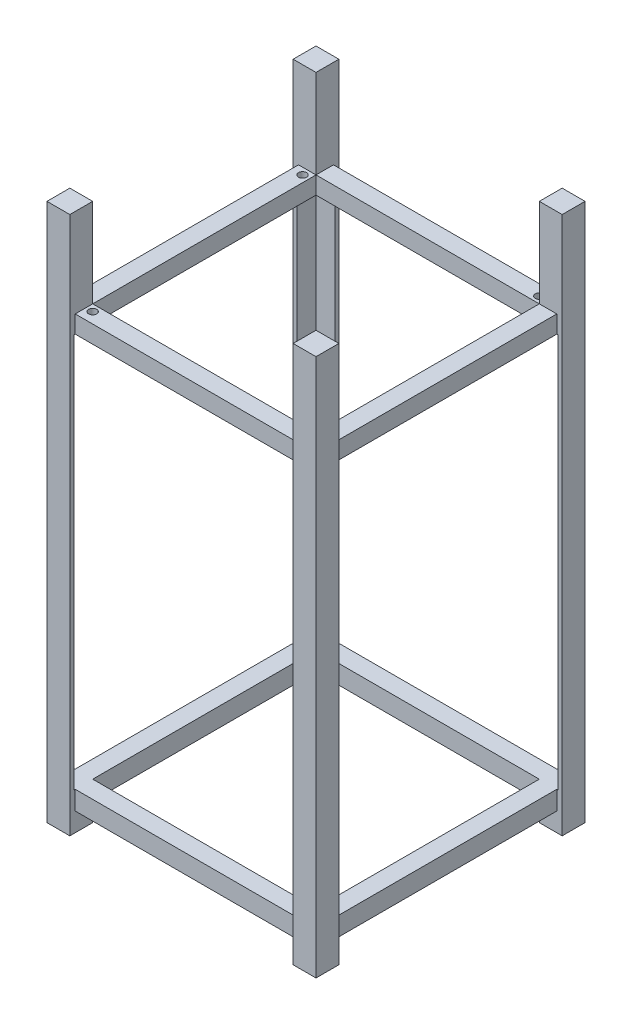
from build123d import *

# Parameters (mm, degrees)
SKETCH1_W           = 100
SKETCH1_H           = 100
BOSS_EXTRUDE1_DEPTH = 200
SKETCH2_W           = 83
SKETCH2_H           = 83
CUT_EXTRUDE1_DEPTH  = 200
SKETCH3_W           = 83
SKETCH3_H           = 14
SKETCH3_H_2         = 146.5
SKETCH3_H_3         = 66
CUT_EXTRUDE2_DEPTH  = 200
SKETCH4_W           = 83
SKETCH4_H           = 14
SKETCH4_H_2         = 146.5
SKETCH4_H_3         = 66
CUT_EXTRUDE3_DEPTH  = 200
SKETCH5_W           = 83
SKETCH5_H           = 4
SKETCH5_W_2         = 4
SKETCH5_H_2         = 83
CUT_EXTRUDE4_DEPTH  = 200
SKETCH8_W           = 97
SKETCH8_H           = 97
CUT_EXTRUDE5_DEPTH  = 146.5
CUT_EXTRUDE6_REACH  = 220.836
SKETCH9_R           = 1.5


with BuildPart() as part:
    # Sketch1 → Boss-Extrude1 (new body)
    with BuildSketch(Plane(origin=(0, 0, 0), x_dir=(1, 0, 0), z_dir=(0, 1, 0))):
        with Locations((50, 50)):
            Rectangle(SKETCH1_W, SKETCH1_H)
    extrude(amount=BOSS_EXTRUDE1_DEPTH)

    # Sketch2 → Cut-Extrude1 (cut)
    with BuildSketch(Plane(origin=(0, 200, 0), x_dir=(1, 0, 0), z_dir=(0, 1, 0))):
        with Locations((50, 50)):
            Rectangle(SKETCH2_W, SKETCH2_H)
    extrude(amount=-CUT_EXTRUDE1_DEPTH, mode=Mode.SUBTRACT)

    # Sketch3 → Cut-Extrude2 (cut)
    with BuildSketch(Plane.XY):
        with Locations((50, 0)):
            Rectangle(SKETCH3_W, SKETCH3_H)
        with Locations((50, 87.25)):
            Rectangle(SKETCH3_W, SKETCH3_H_2)
        with Locations((50, 200)):
            Rectangle(SKETCH3_W, SKETCH3_H_3)
    extrude(amount=-CUT_EXTRUDE2_DEPTH, mode=Mode.SUBTRACT)

    # Sketch4 → Cut-Extrude3 (cut)
    with BuildSketch(Plane.ZY):
        with Locations((-50, 0)):
            Rectangle(SKETCH4_W, SKETCH4_H)
        with Locations((-50, 87.25)):
            Rectangle(SKETCH4_W, SKETCH4_H_2)
        with Locations((-50, 200)):
            Rectangle(SKETCH4_W, SKETCH4_H_3)
    extrude(amount=-CUT_EXTRUDE3_DEPTH, mode=Mode.SUBTRACT)

    # Sketch5 → Cut-Extrude4 (cut)
    with BuildSketch(Plane.XZ.offset(-7)):
        with Locations((50, 0)):
            Rectangle(SKETCH5_W, SKETCH5_H)
        with Locations((100, -50)):
            Rectangle(SKETCH5_W_2, SKETCH5_H_2)
        with Locations((50, -100)):
            Rectangle(SKETCH5_W, SKETCH5_H)
        with Locations((0, -50)):
            Rectangle(SKETCH5_W_2, SKETCH5_H_2)
    extrude(amount=-CUT_EXTRUDE4_DEPTH, mode=Mode.SUBTRACT)

    # Sketch8 → Cut-Extrude5 (cut)
    with BuildSketch(Plane.XZ.offset(-160.5)):
        with Locations((50, -50)):
            Rectangle(SKETCH8_W, SKETCH8_H)
    extrude(amount=CUT_EXTRUDE5_DEPTH, mode=Mode.SUBTRACT)

    # Sketch9 → Cut-Extrude6 (cut, up to next)
    with BuildSketch(Plane(origin=(0, 167, 0), x_dir=(1, 0, 0), z_dir=(0, 1, 0)), mode=Mode.PRIVATE) as cut_extrude6_sk1:
        with Locations(Location((6, 89, 0), (0, 0, 270))):
            Circle(SKETCH9_R)
    cut_extrude6_tool1 = extrude(cut_extrude6_sk1.sketch, amount=-CUT_EXTRUDE6_REACH, mode=Mode.PRIVATE) & part.part
    # Sketch9 → Cut-Extrude6 (cut, up to next)
    with BuildSketch(Plane(origin=(0, 167, 0), x_dir=(1, 0, 0), z_dir=(0, 1, 0)), mode=Mode.PRIVATE) as cut_extrude6_sk2:
        with Locations(Location((89, 94, 0), (0, 0, 270))):
            Circle(SKETCH9_R)
    cut_extrude6_tool2 = extrude(cut_extrude6_sk2.sketch, amount=-CUT_EXTRUDE6_REACH, mode=Mode.PRIVATE) & part.part
    # Sketch9 → Cut-Extrude6 (cut, up to next)
    with BuildSketch(Plane(origin=(0, 167, 0), x_dir=(1, 0, 0), z_dir=(0, 1, 0)), mode=Mode.PRIVATE) as cut_extrude6_sk3:
        with Locations(Location((94, 11, 0), (0, 0, 270))):
            Circle(SKETCH9_R)
    cut_extrude6_tool3 = extrude(cut_extrude6_sk3.sketch, amount=-CUT_EXTRUDE6_REACH, mode=Mode.PRIVATE) & part.part
    # Sketch9 → Cut-Extrude6 (cut, up to next)
    with BuildSketch(Plane(origin=(0, 167, 0), x_dir=(1, 0, 0), z_dir=(0, 1, 0)), mode=Mode.PRIVATE) as cut_extrude6_sk4:
        with Locations(Location((11, 6, 0), (0, 0, 270))):
            Circle(SKETCH9_R)
    cut_extrude6_tool4 = extrude(cut_extrude6_sk4.sketch, amount=-CUT_EXTRUDE6_REACH, mode=Mode.PRIVATE) & part.part
    add(cut_extrude6_tool1.solids().sort_by_distance((6, 167, -89))[0], mode=Mode.SUBTRACT)
    add(cut_extrude6_tool2.solids().sort_by_distance((89, 167, -94))[0], mode=Mode.SUBTRACT)
    add(cut_extrude6_tool3.solids().sort_by_distance((94, 167, -11))[0], mode=Mode.SUBTRACT)
    add(cut_extrude6_tool4.solids().sort_by_distance((11, 167, -6))[0], mode=Mode.SUBTRACT)


solid = part.part
